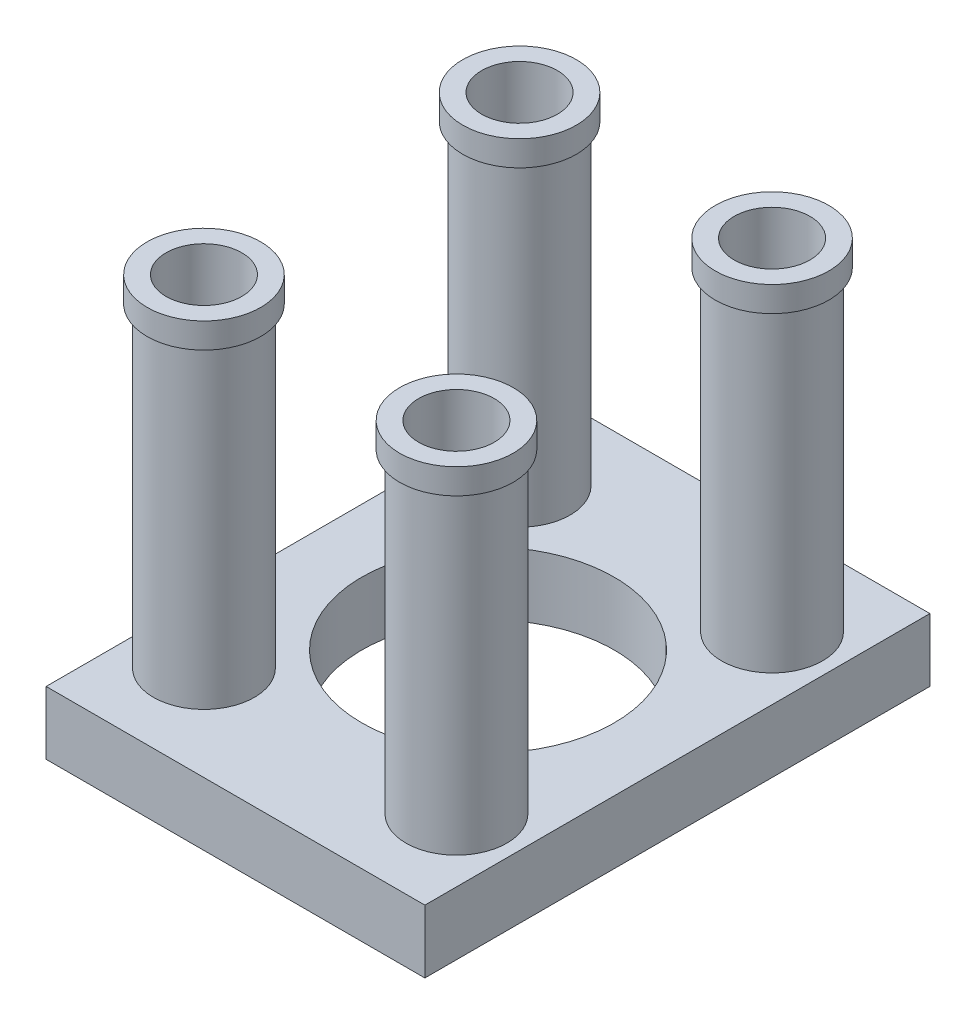
from build123d import *

# Parameters (mm, degrees)
SKETCH1_W           = 38.1
SKETCH1_H           = 50.8
BOSS_EXTRUDE1_DEPTH = 6.35
SKETCH2_R           = 5.08
BOSS_EXTRUDE2_DEPTH = 31.75
SKETCH5_R           = 12.7
CUT_EXTRUDE1_DEPTH  = 45.901280605
SKETCH6_R           = 3.81
CUT_EXTRUDE2_DEPTH  = 50.595085442
BOSS_EXTRUDE3_START = 2.54
SKETCH7_R           = 5.715
SKETCH7_R_2         = 3.81
BOSS_EXTRUDE3_DEPTH = 2.54


with BuildPart() as part:
    # Sketch1 → Boss-Extrude1 (new body)
    with BuildSketch(Plane(origin=(0, 0, 0), x_dir=(1, 0, 0), z_dir=(0, 1, 0))):
        Rectangle(SKETCH1_W, SKETCH1_H)
    extrude(amount=BOSS_EXTRUDE1_DEPTH)

    # Sketch2 → Boss-Extrude2 (add)
    with BuildSketch(Plane(origin=(0, 6.35, 0), x_dir=(1, 0, 0), z_dir=(0, 1, 0))):
        with Locations(Location((-12.7, 15.875, 0), (0, 0, 270))):
            Circle(SKETCH2_R)
        with Locations(Location((12.7, 15.875, 0), (0, 0, 270))):
            Circle(SKETCH2_R)
        with Locations(Location((12.7, -15.875, 0), (0, 0, 270))):
            Circle(SKETCH2_R)
        with Locations(Location((-12.7, -15.875, 0), (0, 0, 270))):
            Circle(SKETCH2_R)
    extrude(amount=BOSS_EXTRUDE2_DEPTH)

    # Sketch5 → Cut-Extrude1 (cut, through all)
    with BuildSketch(Plane(origin=(0, 6.35, 0), x_dir=(1, 0, 0), z_dir=(0, 1, 0))):
        with Locations(Location((0, 0, 0), (0, 0, 270))):
            Circle(SKETCH5_R)
    extrude(amount=-CUT_EXTRUDE1_DEPTH, mode=Mode.SUBTRACT)

    # Sketch6 → Cut-Extrude2 (cut, through all)
    with BuildSketch(Plane(origin=(0, 38.1, 0), x_dir=(1, 0, 0), z_dir=(0, 1, 0))):
        with Locations(Location((-12.7, 15.875, 0), (0, 0, 270))):
            Circle(SKETCH6_R)
        with Locations(Location((12.7, 15.875, 0), (0, 0, 270))):
            Circle(SKETCH6_R)
        with Locations(Location((12.7, -15.875, 0), (0, 0, 270))):
            Circle(SKETCH6_R)
        with Locations(Location((-12.7, -15.875, 0), (0, 0, 270))):
            Circle(SKETCH6_R)
    extrude(amount=-CUT_EXTRUDE2_DEPTH, mode=Mode.SUBTRACT)

    # Sketch7 → Boss-Extrude3 (add)
    # profile 1 of 4: a face of its own
    with BuildSketch(Plane(origin=(0, 38.1, 0), x_dir=(1, 0, 0), z_dir=(0, 1, 0)).offset(BOSS_EXTRUDE3_START)):
        with Locations(Location((-12.7, 15.875, 0), (0, 0, 270))):
            Circle(SKETCH7_R)
        with Locations(Location((-12.7, 15.875, 0), (0, 0, 270))):
            Circle(SKETCH7_R_2, mode=Mode.SUBTRACT)
    # profile 2 of 4: a face of its own
    with BuildSketch(Plane(origin=(0, 38.1, 0), x_dir=(1, 0, 0), z_dir=(0, 1, 0)).offset(BOSS_EXTRUDE3_START)):
        with Locations(Location((-12.7, -15.875, 0), (0, 0, 270))):
            Circle(SKETCH7_R)
        with Locations(Location((-12.7, -15.875, 0), (0, 0, 270))):
            Circle(SKETCH7_R_2, mode=Mode.SUBTRACT)
    # profile 3 of 4: a face of its own
    with BuildSketch(Plane(origin=(0, 38.1, 0), x_dir=(1, 0, 0), z_dir=(0, 1, 0)).offset(BOSS_EXTRUDE3_START)):
        with Locations(Location((12.7, -15.875, 0), (0, 0, 270))):
            Circle(SKETCH7_R)
        with Locations(Location((12.7, -15.875, 0), (0, 0, 270))):
            Circle(SKETCH7_R_2, mode=Mode.SUBTRACT)
    # profile 4 of 4: a face of its own
    with BuildSketch(Plane(origin=(0, 38.1, 0), x_dir=(1, 0, 0), z_dir=(0, 1, 0)).offset(BOSS_EXTRUDE3_START)):
        with Locations(Location((12.7, 15.875, 0), (0, 0, 270))):
            Circle(SKETCH7_R)
        with Locations(Location((12.7, 15.875, 0), (0, 0, 270))):
            Circle(SKETCH7_R_2, mode=Mode.SUBTRACT)
    extrude(amount=-BOSS_EXTRUDE3_DEPTH)


solid = part.part
